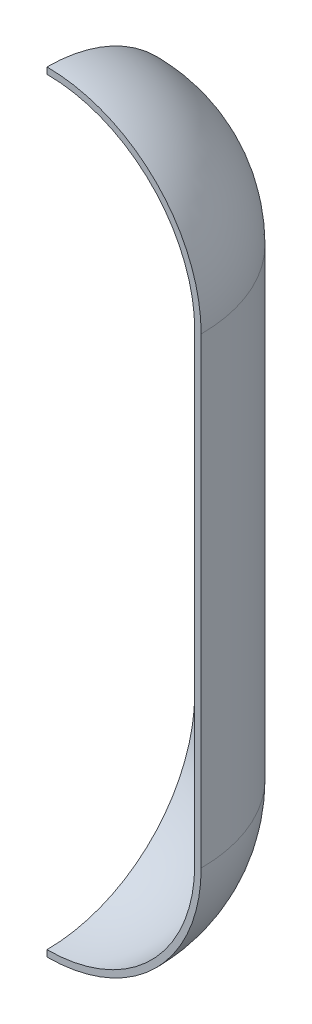
from build123d import *

# Parameters (mm, degrees)
REVOLVE1_ANGLE = 90


with BuildPart() as part:
    # Sketch1 → Revolve1 (revolve)
    with BuildSketch(Plane.XY):
        with BuildLine():
            Line((304.8, 0), (304.8, 914.4))
            ThreePointArc((304.8, 914.4), (215.526146906, 1129.926146906), (0, 1219.2))
            Line((0, 1219.2), (0, 1206.5))
            ThreePointArc((0, 1206.5), (206.545890785, 1120.945890785), (292.1, 914.4))
            Line((292.1, 914.4), (292.1, 0))
            ThreePointArc((292.1, 0), (206.545890785, -206.545890785), (0, -292.1))
            Line((0, -292.1), (0, -304.8))
            ThreePointArc((0, -304.8), (215.526146906, -215.526146906), (304.8, 0))
        make_face()
    revolve(axis=Axis((0, 1258.634144443, 0), (0, 1, 0)), revolution_arc=REVOLVE1_ANGLE)


solid = part.part
